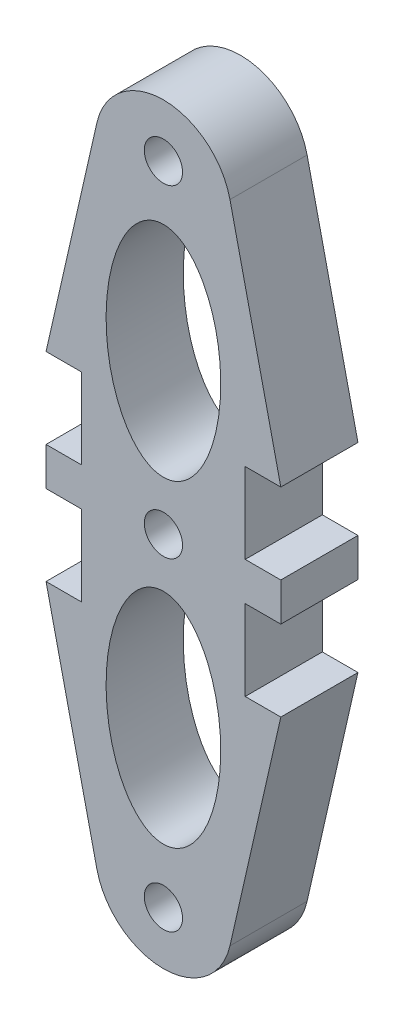
from build123d import *

# Parameters (mm, degrees)
SKETCH1_R           = 1.45
SKETCH1_RX          = 8.302080555
SKETCH1_RY          = 4.346497416
BOSS_EXTRUDE1_DEPTH = 5.85


with BuildPart() as part:
    # Sketch1 → Boss-Extrude1 (new body)
    with BuildSketch(Plane.XY):
        with BuildLine():
            Line((781.459168709, 464.852359197), (778.759168709, 464.852359197))
            Line((778.759168709, 464.852359197), (778.759168709, 461.952359197))
            Line((778.759168709, 461.952359197), (781.459168709, 461.952359197))
            Line((781.459168709, 461.952359197), (781.459168709, 455.852359197))
            Line((781.459168709, 455.852359197), (778.759168709, 455.852359197))
            Line((778.759168709, 455.852359197), (782.614024727, 438.902359197))
            ThreePointArc((782.614024727, 438.902359197), (787.659168709, 434.875779626), (792.704312691, 438.902359197))
            Line((792.704312691, 438.902359197), (796.559168709, 455.852359197))
            Line((796.559168709, 455.852359197), (793.859168709, 455.852359197))
            Line((793.859168709, 455.852359197), (793.859168709, 461.952359197))
            Line((793.859168709, 461.952359197), (796.559168709, 461.952359197))
            Line((796.559168709, 461.952359197), (796.559168709, 464.852359197))
            Line((796.559168709, 464.852359197), (793.859168709, 464.852359197))
            Line((793.859168709, 464.852359197), (793.859168709, 470.952359197))
            Line((793.859168709, 470.952359197), (796.559168709, 470.952359197))
            Line((796.559168709, 470.952359197), (792.704312691, 487.902359197))
            ThreePointArc((792.704312691, 487.902359197), (787.659168709, 491.928938767), (782.614024727, 487.902359197))
            Line((782.614024727, 487.902359197), (778.759168709, 470.952359197))
            Line((778.759168709, 470.952359197), (781.459168709, 470.952359197))
            Line((781.459168709, 470.952359197), (781.459168709, 464.852359197))
        make_face()
        with Locations((787.659168709, 487.902359197)):
            Circle(SKETCH1_R, mode=Mode.SUBTRACT)
        with Locations((787.659168709, 438.902359197)):
            Circle(SKETCH1_R, mode=Mode.SUBTRACT)
        with Locations((787.659168709, 463.402359197)):
            Circle(SKETCH1_R, mode=Mode.SUBTRACT)
        with Locations(Location((787.659168709, 475.448118238), (0, 0, 90))):
            Ellipse(SKETCH1_RX, SKETCH1_RY, mode=Mode.SUBTRACT)
        with Locations(Location((787.659168709, 451.356600156), (0, 0, -90))):
            Ellipse(SKETCH1_RX, SKETCH1_RY, mode=Mode.SUBTRACT)
    extrude(amount=BOSS_EXTRUDE1_DEPTH)


solid = part.part
